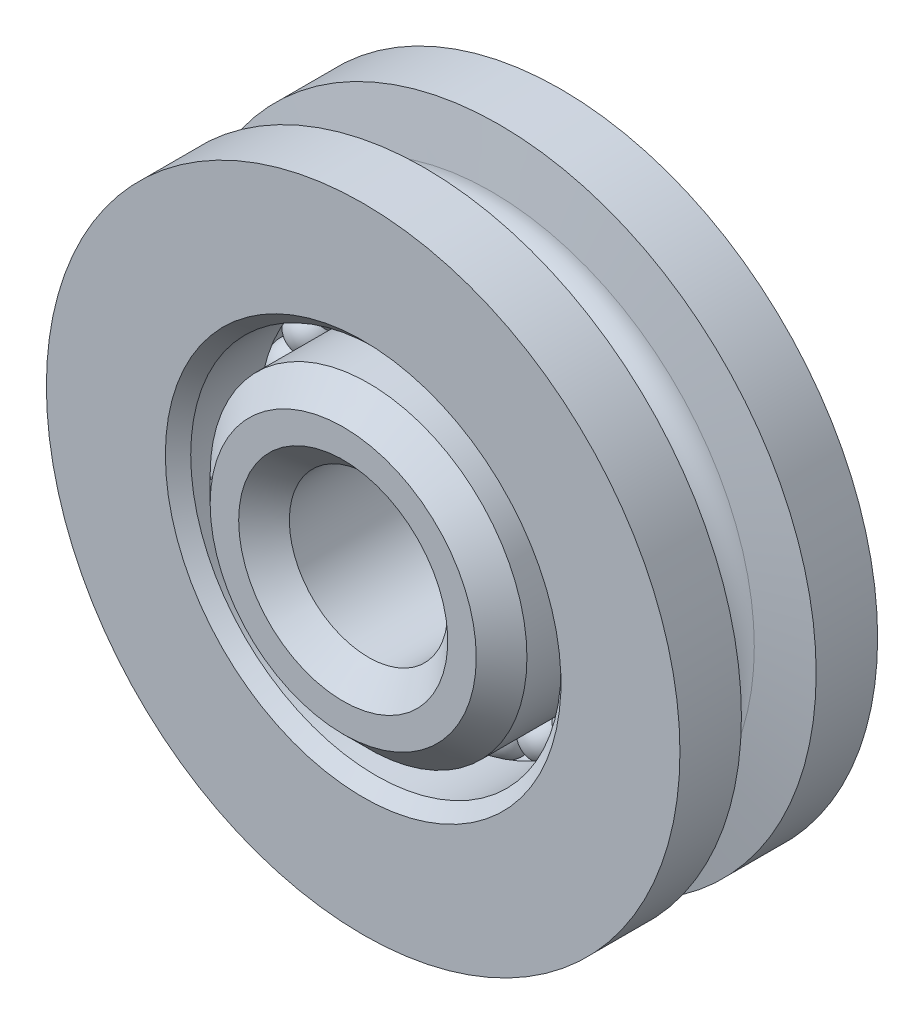
from build123d import *

# Parameters (mm, degrees)
CIRPATTERN1_COUNT = 24
CHAMFER1_SIZE     = 0.508
CHAMFER2_SIZE     = 0.254


with BuildPart() as part:
    # Sketch1 → Revolve1 (revolve)
    with BuildSketch(Plane(origin=(0, 0, 0), x_dir=(0, 0, -1), z_dir=(1, 0, 0)), mode=Mode.PRIVATE) as revolve1_sk:
        with BuildLine():
            Line((0.7493, 6.35), (1.9812, 6.35))
            Line((1.9812, 6.35), (1.9812, 3.71078125))
            Line((1.9812, 3.71078125), (0.3571875, 3.71078125))
            ThreePointArc((0.3571875, 3.71078125), (0, 3.889375), (-0.3571875, 3.71078125))
            Line((-0.3571875, 3.71078125), (-1.9812, 3.71078125))
            Line((-1.9812, 3.71078125), (-1.9812, 6.35))
            Line((-1.9812, 6.35), (-0.7493, 6.35))
            Line((-0.7493, 6.35), (-0.588845646, 5.270303768))
            ThreePointArc((-0.588845646, 5.270303768), (0, 4.7625), (0.588845646, 5.270303768))
            Line((0.588845646, 5.270303768), (0.7493, 6.35))
        make_face()
        with BuildLine():
            Line((2.38125, 1.5875), (-2.38125, 1.5875))
            Line((-2.38125, 1.5875), (-2.38125, 3.175))
            Line((-2.38125, 3.175), (-0.3571875, 3.175))
            ThreePointArc((-0.3571875, 3.175), (0, 2.99640625), (0.3571875, 3.175))
            Line((0.3571875, 3.175), (2.38125, 3.175))
            Line((2.38125, 3.175), (2.38125, 1.5875))
        make_face()
    revolve(revolve1_sk.sketch.rotate(Axis((0, 0, 2.38125), (0, 0, -1)), 90), axis=Axis((0, 0, 2.38125), (0, 0, -1)))

    # Chamfer1
    chamfer1_edges = [part.edges().sort_by_distance(p)[0] for p in [
        (-3.175, 0, 2.38125),
        (-3.175, 0, -2.38125),
        (-1.5875, 0, -2.38125),
        (-1.5875, 0, 2.38125),
    ]]
    chamfer(chamfer1_edges, length=CHAMFER1_SIZE)

    # Chamfer2
    chamfer2_edges = [part.edges().sort_by_distance(p)[0] for p in [
        (-3.71078125, 0, -1.9812),
        (-3.71078125, 0, 1.9812),
    ]]
    chamfer(chamfer2_edges, length=CHAMFER2_SIZE)


with BuildPart() as body_2:
    # Sketch2 → Revolve2 (revolve)
    with BuildSketch(Plane(origin=(0, 0, 0), x_dir=(0, 0, -1), z_dir=(1, 0, 0))):
        with BuildLine():
            Line((0, 3.889375), (0, 2.99640625))
            ThreePointArc((0, 2.99640625), (0.446484375, 3.442890625), (0, 3.889375))
        make_face()
    revolve(axis=Axis((0, 3.889375, 0), (0, -1, 0)))


with BuildPart() as cirpattern1_1:
    # CirPattern1: pattern copy
    add(body_2.part.rotate(Axis((0, 0, 0), (0, 0, 1)), 1 * 360 / CIRPATTERN1_COUNT))


with BuildPart() as cirpattern1_2:
    # CirPattern1: pattern copy
    add(body_2.part.rotate(Axis((0, 0, 0), (0, 0, 1)), 2 * 360 / CIRPATTERN1_COUNT))


with BuildPart() as cirpattern1_3:
    # CirPattern1: pattern copy
    add(body_2.part.rotate(Axis((0, 0, 0), (0, 0, 1)), 3 * 360 / CIRPATTERN1_COUNT))


with BuildPart() as cirpattern1_4:
    # CirPattern1: pattern copy
    add(body_2.part.rotate(Axis((0, 0, 0), (0, 0, 1)), 4 * 360 / CIRPATTERN1_COUNT))


with BuildPart() as cirpattern1_5:
    # CirPattern1: pattern copy
    add(body_2.part.rotate(Axis((0, 0, 0), (0, 0, 1)), 5 * 360 / CIRPATTERN1_COUNT))


with BuildPart() as cirpattern1_6:
    # CirPattern1: pattern copy
    add(body_2.part.rotate(Axis((0, 0, 0), (0, 0, 1)), 6 * 360 / CIRPATTERN1_COUNT))


with BuildPart() as cirpattern1_7:
    # CirPattern1: pattern copy
    add(body_2.part.rotate(Axis((0, 0, 0), (0, 0, 1)), 7 * 360 / CIRPATTERN1_COUNT))


with BuildPart() as cirpattern1_8:
    # CirPattern1: pattern copy
    add(body_2.part.rotate(Axis((0, 0, 0), (0, 0, 1)), 8 * 360 / CIRPATTERN1_COUNT))


with BuildPart() as cirpattern1_9:
    # CirPattern1: pattern copy
    add(body_2.part.rotate(Axis((0, 0, 0), (0, 0, 1)), 9 * 360 / CIRPATTERN1_COUNT))


with BuildPart() as cirpattern1_10:
    # CirPattern1: pattern copy
    add(body_2.part.rotate(Axis((0, 0, 0), (0, 0, 1)), 10 * 360 / CIRPATTERN1_COUNT))


with BuildPart() as cirpattern1_11:
    # CirPattern1: pattern copy
    add(body_2.part.rotate(Axis((0, 0, 0), (0, 0, 1)), 11 * 360 / CIRPATTERN1_COUNT))


with BuildPart() as cirpattern1_12:
    # CirPattern1: pattern copy
    add(body_2.part.rotate(Axis((0, 0, 0), (0, 0, 1)), 12 * 360 / CIRPATTERN1_COUNT))


with BuildPart() as cirpattern1_13:
    # CirPattern1: pattern copy
    add(body_2.part.rotate(Axis((0, 0, 0), (0, 0, 1)), 13 * 360 / CIRPATTERN1_COUNT))


with BuildPart() as cirpattern1_14:
    # CirPattern1: pattern copy
    add(body_2.part.rotate(Axis((0, 0, 0), (0, 0, 1)), 14 * 360 / CIRPATTERN1_COUNT))


with BuildPart() as cirpattern1_15:
    # CirPattern1: pattern copy
    add(body_2.part.rotate(Axis((0, 0, 0), (0, 0, 1)), 15 * 360 / CIRPATTERN1_COUNT))


with BuildPart() as cirpattern1_16:
    # CirPattern1: pattern copy
    add(body_2.part.rotate(Axis((0, 0, 0), (0, 0, 1)), 16 * 360 / CIRPATTERN1_COUNT))


with BuildPart() as cirpattern1_17:
    # CirPattern1: pattern copy
    add(body_2.part.rotate(Axis((0, 0, 0), (0, 0, 1)), 17 * 360 / CIRPATTERN1_COUNT))


with BuildPart() as cirpattern1_18:
    # CirPattern1: pattern copy
    add(body_2.part.rotate(Axis((0, 0, 0), (0, 0, 1)), 18 * 360 / CIRPATTERN1_COUNT))


with BuildPart() as cirpattern1_19:
    # CirPattern1: pattern copy
    add(body_2.part.rotate(Axis((0, 0, 0), (0, 0, 1)), 19 * 360 / CIRPATTERN1_COUNT))


with BuildPart() as cirpattern1_20:
    # CirPattern1: pattern copy
    add(body_2.part.rotate(Axis((0, 0, 0), (0, 0, 1)), 20 * 360 / CIRPATTERN1_COUNT))


with BuildPart() as cirpattern1_21:
    # CirPattern1: pattern copy
    add(body_2.part.rotate(Axis((0, 0, 0), (0, 0, 1)), 21 * 360 / CIRPATTERN1_COUNT))


with BuildPart() as cirpattern1_22:
    # CirPattern1: pattern copy
    add(body_2.part.rotate(Axis((0, 0, 0), (0, 0, 1)), 22 * 360 / CIRPATTERN1_COUNT))


with BuildPart() as cirpattern1_23:
    # CirPattern1: pattern copy
    add(body_2.part.rotate(Axis((0, 0, 0), (0, 0, 1)), 23 * 360 / CIRPATTERN1_COUNT))


solid = Compound([part.part, body_2.part, cirpattern1_1.part, cirpattern1_2.part, cirpattern1_3.part, cirpattern1_4.part, cirpattern1_5.part, cirpattern1_6.part, cirpattern1_7.part, cirpattern1_8.part, cirpattern1_9.part, cirpattern1_10.part, cirpattern1_11.part, cirpattern1_12.part, cirpattern1_13.part, cirpattern1_14.part, cirpattern1_15.part, cirpattern1_16.part, cirpattern1_17.part, cirpattern1_18.part, cirpattern1_19.part, cirpattern1_20.part, cirpattern1_21.part, cirpattern1_22.part, cirpattern1_23.part])
